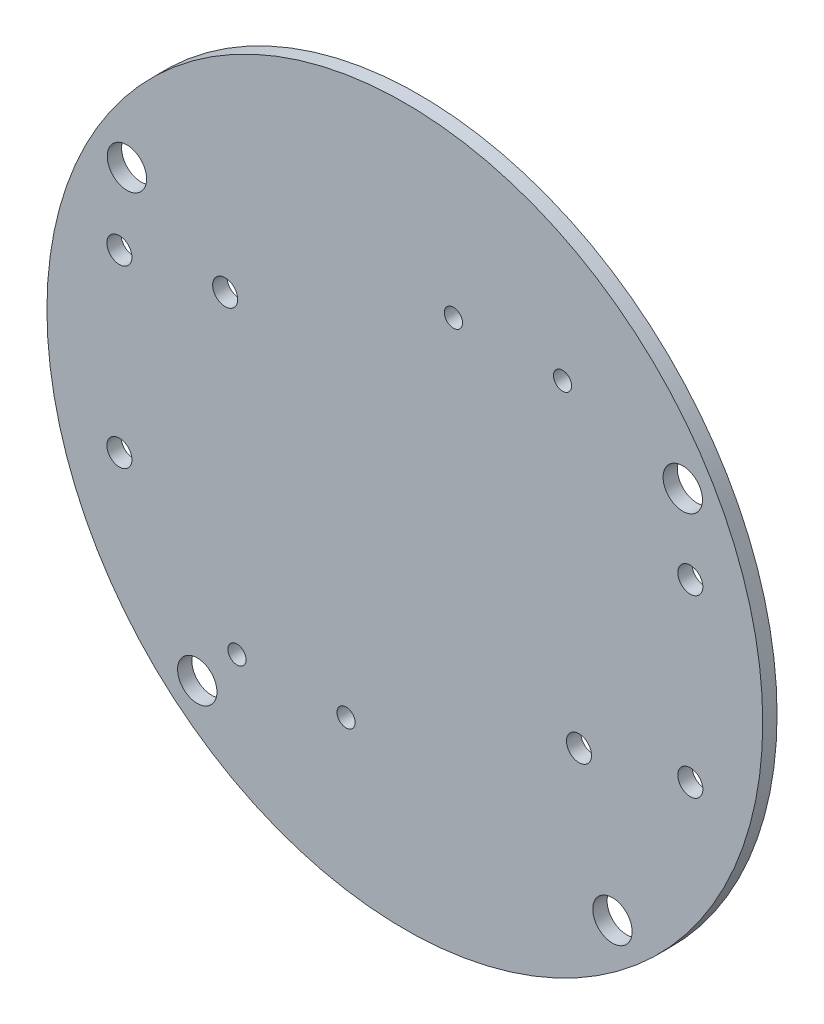
from build123d import *

# Parameters (mm, degrees)
ESBO_O1_R                = 50
RESSALTO_EXTRUS_O1_DEPTH = 2
ESBO_O2_R                = 2.75
CORTE_EXTRUS_O1_DEPTH    = 2
ESBO_O3_R                = 1.75
ESBO_O3_R_2              = 1.27
CORTE_EXTRUS_O2_DEPTH    = 10


with BuildPart() as part:
    # Esboço1 → Ressalto-extrusão1 (new body)
    with BuildSketch(Plane.XY):
        Circle(ESBO_O1_R)
    extrude(amount=RESSALTO_EXTRUS_O1_DEPTH)

    # Esboço2 → Corte-extrusão1 (cut)
    with BuildSketch(Plane.XY.offset(2)):
        with Locations((-29, -34.409301068)):
            Circle(ESBO_O2_R)
        with Locations((29, -34.409301068)):
            Circle(ESBO_O2_R)
        with Locations((-38.824197531, 22.752619324)):
            Circle(ESBO_O2_R)
        with Locations((38.824197531, 22.752619324)):
            Circle(ESBO_O2_R)
    extrude(amount=-CORTE_EXTRUS_O1_DEPTH, mode=Mode.SUBTRACT)

    # Esboço3 → Corte-extrusão2 (cut)
    with BuildSketch(Plane.XY.offset(2)):
        with Locations((-25.1, 14.54)):
            Circle(ESBO_O3_R)
        with Locations((24.33, -15.91)):
            Circle(ESBO_O3_R)
        with Locations((-39.88, -12.25)):
            Circle(ESBO_O3_R)
        with Locations((-39.88, 12.25)):
            Circle(ESBO_O3_R)
        with Locations((39.88, 12.25)):
            Circle(ESBO_O3_R)
        with Locations((39.88, -12.25)):
            Circle(ESBO_O3_R)
        with Locations((6.79, 27.4)):
            Circle(ESBO_O3_R_2)
        with Locations((22.03, 27.4)):
            Circle(ESBO_O3_R_2)
        with Locations((-8.21, -28.46)):
            Circle(ESBO_O3_R_2)
        with Locations((-23.45, -28.46)):
            Circle(ESBO_O3_R_2)
    extrude(amount=-CORTE_EXTRUS_O2_DEPTH, mode=Mode.SUBTRACT)


solid = part.part
